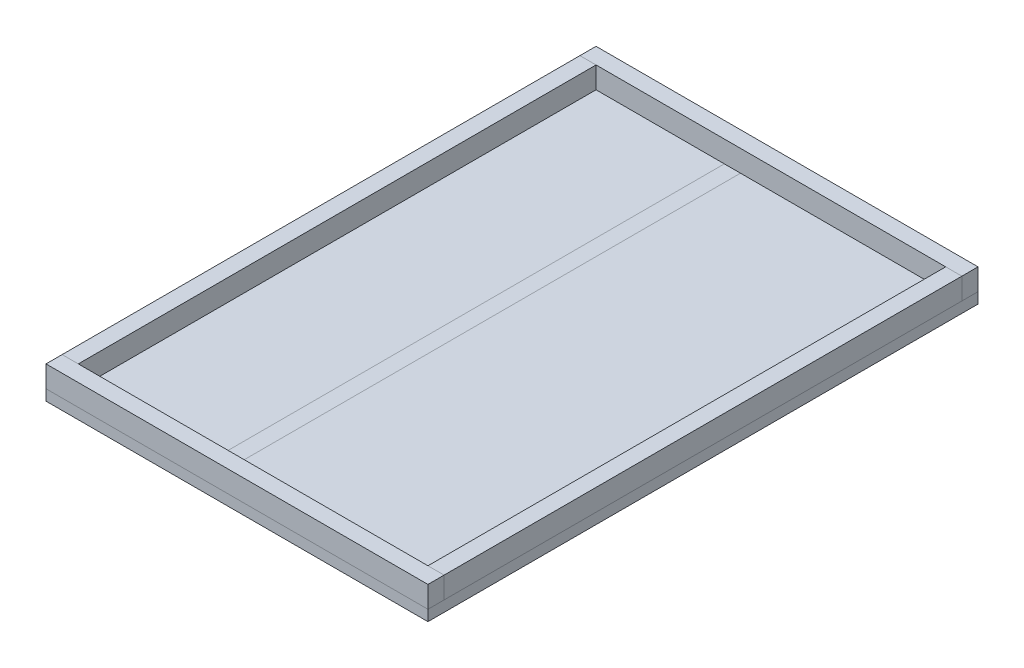
from build123d import *

# Parameters (mm, degrees)
SKETCH1_W             = 450.8
SKETCH1_H             = 649.2
BOSS_EXTRUDE1_DEPTH   = 12.7
SKETCH1_3_W           = 19.05
SKETCH1_3_H           = 611.1
BOSS_EXTRUDE2_DEPTH   = 25.4
BOSS_EXTRUDE2_2_DEPTH = 25.4
SKETCH1_4_W           = 450.8
SKETCH1_4_H           = 19.05
BOSS_EXTRUDE3_DEPTH   = 25.4
BOSS_EXTRUDE3_2_DEPTH = 25.4
SKETCH4_W             = 101.6
SKETCH4_H             = 611.1
BOSS_EXTRUDE5_DEPTH   = 12.7
SKETCH2_W             = 19.05
SKETCH2_H             = 611.1
CUT_EXTRUDE1_DEPTH    = 12.7
SKETCH2_2_W           = 19.05
SKETCH2_2_H           = 611.1
BOSS_EXTRUDE4_DEPTH   = 9.525


with BuildPart() as part:
    # Sketch1 → Boss-Extrude1 (new body)
    with BuildSketch(Plane(origin=(0, 0, 0), x_dir=(1, 0, 0), z_dir=(0, 1, 0))):
        Rectangle(SKETCH1_W, SKETCH1_H)
    extrude(amount=-BOSS_EXTRUDE1_DEPTH)

    # Sketch2 → Cut-Extrude1 (cut)
    with BuildSketch(Plane(origin=(0, 0, 0), x_dir=(1, 0, 0), z_dir=(0, 1, 0))):
        with Locations((-45.4, 0)):
            Rectangle(SKETCH2_W, SKETCH2_H)
    extrude(amount=-CUT_EXTRUDE1_DEPTH, mode=Mode.SUBTRACT)


with BuildPart() as body_2:
    # Sketch1<3> → Boss-Extrude2 (new body)
    with BuildSketch(Plane(origin=(0, 0, 0), x_dir=(1, 0, 0), z_dir=(0, 1, 0))):
        with Locations((215.875, 0)):
            Rectangle(SKETCH1_3_W, SKETCH1_3_H)
    extrude(amount=BOSS_EXTRUDE2_DEPTH)


with BuildPart() as body_3:
    # Sketch1<3> → Boss-Extrude2 2 (new body)
    with BuildSketch(Plane(origin=(0, 0, 0), x_dir=(1, 0, 0), z_dir=(0, 1, 0))):
        with Locations((-215.875, 0)):
            Rectangle(SKETCH1_3_W, SKETCH1_3_H)
    extrude(amount=BOSS_EXTRUDE2_2_DEPTH)


with BuildPart() as body_4:
    # Sketch1<4> → Boss-Extrude3 (new body)
    with BuildSketch(Plane(origin=(0, 0, 0), x_dir=(1, 0, 0), z_dir=(0, 1, 0))):
        with Locations((0, 315.075)):
            Rectangle(SKETCH1_4_W, SKETCH1_4_H)
    extrude(amount=BOSS_EXTRUDE3_DEPTH)


with BuildPart() as body_5:
    # Sketch1<4> → Boss-Extrude3 2 (new body)
    with BuildSketch(Plane(origin=(0, 0, 0), x_dir=(1, 0, 0), z_dir=(0, 1, 0))):
        with Locations((0, -315.075)):
            Rectangle(SKETCH1_4_W, SKETCH1_4_H)
    extrude(amount=BOSS_EXTRUDE3_2_DEPTH)


with BuildPart() as body_6:
    # Sketch4 → Boss-Extrude5 (new body)
    with BuildSketch(Plane.XZ.offset(12.7)):
        with Locations((-45.4, 0)):
            Rectangle(SKETCH4_W, SKETCH4_H)
    extrude(amount=BOSS_EXTRUDE5_DEPTH)


with BuildPart() as body_7:
    # Sketch2<2> → Boss-Extrude4 (new body)
    with BuildSketch(Plane(origin=(0, 0, 0), x_dir=(1, 0, 0), z_dir=(0, 1, 0))):
        with Locations((-45.4, 0)):
            Rectangle(SKETCH2_2_W, SKETCH2_2_H)
    extrude(amount=-BOSS_EXTRUDE4_DEPTH)


solid = Compound([part.part, body_2.part, body_3.part, body_4.part, body_5.part, body_6.part, body_7.part])
